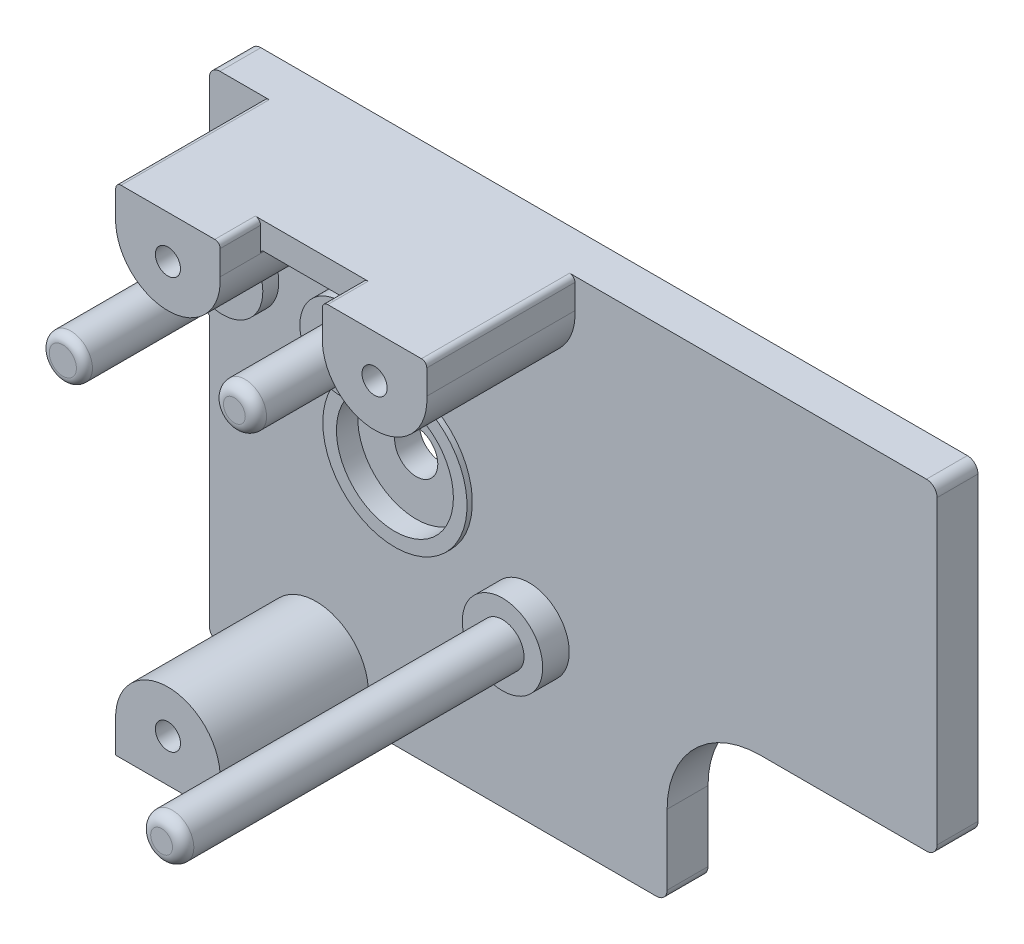
from build123d import *

# Parameters (mm, degrees)
SALIENTE_EXTRUIR1_DEPTH    = 3.84
SALIENTE_EXTRUIR2_DEPTH    = 27.82
CROQUIS5_W                 = 19.2
CROQUIS5_H                 = 4.96
SALIENTE_EXTRUIR3_DEPTH    = 20.22
REDONDEO1_R                = 0.6
REDONDEO4_R                = 0.6
CROQUIS6_R                 = 2.36
CORTAR_EXTRUIR1_DEPTH      = 53.95
SALIENTE_EXTRUIR6_DEPTH    = 27.82
CORTAR_EXTRUIR9_DEPTH      = 53
CORTAR_EXTRUIR9_DEPTH_BACK = 66
CROQUIS10_R                = 2.36
REDONDEO5_R                = 5
REDONDEO6_R                = 5
CROQUIS12_R                = 4.05
CORTAR_EXTRUIR10_DEPTH     = 15
REDONDEO8_R                = 2
REDONDEO9_R                = 1
REDONDEO10_R               = 1
REDONDEO12_R               = 2
REDONDEO13_R               = 1
REDONDEO14_R               = 1
REDONDEO15_R               = 2
REDONDEO16_R               = 2
REDONDEO17_R               = 2
REDONDEO18_R               = 1
CROQUIS14_R                = 13.54
SALIENTE_EXTRUIR7_DEPTH    = 1
CROQUIS15_R                = 10.98
CORTAR_EXTRUIR12_DEPTH     = 4
CROQUIS16_R                = 4.05
CORTAR_EXTRUIR13_DEPTH     = 24
CROQUIS17_R                = 7.545
SALIENTE_EXTRUIR8_DEPTH    = 3
SALIENTE_EXTRUIR9_DEPTH    = 5
SALIENTE_EXTRUIR10_DEPTH   = 4
SALIENTE_EXTRUIR11_START   = 20
CROQUIS23_R                = 4.05
SALIENTE_EXTRUIR11_DEPTH   = 20
SALIENTE_EXTRUIR12_START   = 30
CROQUIS18_R                = 4.05
SALIENTE_EXTRUIR12_DEPTH   = 30
REDONDEO19_R               = 1.5
REDONDEO20_R               = 2
CROQUIS24_R                = 7.545
SALIENTE_EXTRUIR13_DEPTH   = 5
CROQUIS25_R                = 4.05
SALIENTE_EXTRUIR14_DEPTH   = 64
REDONDEO21_R               = 2


with BuildPart() as part:
    # Croquis1 → Saliente-Extruir1 (new, symmetric)
    with BuildSketch(Plane.XY):
        with BuildLine():
            Line((-68.325, 28.78), (68.325, 28.78))
            Line((68.325, 28.78), (68.325, -31.7))
            Line((68.325, -31.7), (35.165, -31.7))
            ThreePointArc((35.165, -31.7), (22.769418126, -36.834418126), (17.635, -49.23))
            Line((17.635, -49.23), (17.635, -64.4))
            Line((17.635, -64.4), (-68.325, -64.4))
            Line((-68.325, -64.4), (-68.325, -11.9))
            Line((-68.325, -11.9), (-73.325, -7.775))
            Line((-73.325, -7.775), (-73.325, 7.775))
            Line((-73.325, 7.775), (-68.325, 11.9))
            Line((-68.325, 11.9), (-68.325, 28.78))
        make_face()
    extrude(amount=SALIENTE_EXTRUIR1_DEPTH, both=True)

    # Croquis2 → Saliente-Extruir2 (add)
    with BuildSketch(Plane.XY.offset(3.84)):
        with BuildLine():
            Line((-58.075, 23.18), (-58.075, 28.78))
            Line((-58.075, 28.78), (-38.475, 28.78))
            Line((-38.475, 28.78), (-38.475, 23.18))
            ThreePointArc((-38.475, 23.18), (-48.275, 12.78), (-58.075, 23.18))
        make_face()
        with BuildLine():
            Line((-19.275, 23.18), (-19.275, 28.78))
            Line((-19.275, 28.78), (0.325, 28.78))
            Line((0.325, 28.78), (0.325, 23.18))
            ThreePointArc((0.325, 23.18), (-9.475, 12.78), (-19.275, 23.18))
        make_face()
    extrude(amount=SALIENTE_EXTRUIR2_DEPTH)

    # Croquis5 → Saliente-Extruir3 (add)
    with BuildSketch(Plane.XY.offset(3.84)):
        with Locations((-28.875, 26.3)):
            Rectangle(CROQUIS5_W, CROQUIS5_H)
    extrude(amount=SALIENTE_EXTRUIR3_DEPTH)

    # Redondeo1
    redondeo1_edges = [part.edges().sort_by_distance(p)[0] for p in [
        (-38.475, 23.82, 13.95),
    ]]
    fillet(redondeo1_edges, radius=REDONDEO1_R)

    # Redondeo4
    redondeo4_edges = [part.edges().sort_by_distance(p)[0] for p in [
        (-19.275, 23.82, 13.95),
    ]]
    fillet(redondeo4_edges, radius=REDONDEO4_R)

    # Croquis6 → Cortar-Extruir1 (cut, symmetric)
    with BuildSketch(Plane.XY):
        with Locations((-48.275, 20.78)):
            Circle(CROQUIS6_R)
        with Locations((-9.475, 20.78)):
            Circle(CROQUIS6_R)
    extrude(amount=CORTAR_EXTRUIR1_DEPTH, both=True, mode=Mode.SUBTRACT)

    # Croquis9 → Saliente-Extruir6 (add)
    with BuildSketch(Plane.XY.offset(3.84)):
        with BuildLine():
            Line((-58.075, -58.8), (-58.075, -64.4))
            Line((-58.075, -64.4), (-38.475, -64.4))
            Line((-38.475, -64.4), (-38.475, -58.8))
            ThreePointArc((-38.475, -58.8), (-48.275, -48.4), (-58.075, -58.8))
        make_face()
    extrude(amount=SALIENTE_EXTRUIR6_DEPTH)

    # Croquis10 → Cortar-Extruir9 (cut, two sides: drawn at the far end of the back side and taken through both)
    with BuildSketch(Plane.XY.offset(3.84).offset(-CORTAR_EXTRUIR9_DEPTH_BACK)):
        with Locations(Location((-48.275, -56.4, 0), (0, 0, 180))):
            Circle(CROQUIS10_R)
    extrude(amount=CORTAR_EXTRUIR9_DEPTH + CORTAR_EXTRUIR9_DEPTH_BACK, mode=Mode.SUBTRACT)

    # Redondeo5
    redondeo5_edges = [part.edges().sort_by_distance(p)[0] for p in [
        (-73.325, -7.775, 0),
    ]]
    fillet(redondeo5_edges, radius=REDONDEO5_R)

    # Redondeo6
    redondeo6_edges = [part.edges().sort_by_distance(p)[0] for p in [
        (-73.325, 7.775, 0),
    ]]
    fillet(redondeo6_edges, radius=REDONDEO6_R)

    # Croquis12 → Cortar-Extruir10 (cut, symmetric)
    with BuildSketch(Plane.XY.offset(3.84)):
        with Locations(Location((-62.825, 0, 0), (0, 0, 180))):
            Circle(CROQUIS12_R)
        with Locations(Location((-38.625, 0, 0), (0, 0, 180))):
            Circle(CROQUIS12_R)
    extrude(amount=CORTAR_EXTRUIR10_DEPTH, both=True, mode=Mode.SUBTRACT)

    # Redondeo8
    redondeo8_edges = [part.edges().sort_by_distance(p)[0] for p in [
        (-68.325, 28.78, 0),
    ]]
    fillet(redondeo8_edges, radius=REDONDEO8_R)

    # Redondeo9
    redondeo9_edges = [part.edges().sort_by_distance(p)[0] for p in [
        (-58.075, 28.78, 17.75),
    ]]
    fillet(redondeo9_edges, radius=REDONDEO9_R)

    # Redondeo10
    redondeo10_edges = [part.edges().sort_by_distance(p)[0] for p in [
        (-19.275, 28.78, 27.86),
    ]]
    fillet(redondeo10_edges, radius=REDONDEO10_R)

    # Redondeo12
    redondeo12_edges = [part.edges().sort_by_distance(p)[0] for p in [
        (-68.325, -64.4, 0),
    ]]
    fillet(redondeo12_edges, radius=REDONDEO12_R)

    # Redondeo13
    redondeo13_edges = [part.edges().sort_by_distance(p)[0] for p in [
        (-38.475, 28.78, 27.86),
    ]]
    fillet(redondeo13_edges, radius=REDONDEO13_R)

    # Redondeo14
    redondeo14_edges = [part.edges().sort_by_distance(p)[0] for p in [
        (0.325, 28.78, 17.75),
    ]]
    fillet(redondeo14_edges, radius=REDONDEO14_R)

    # Redondeo15
    redondeo15_edges = [part.edges().sort_by_distance(p)[0] for p in [
        (68.325, 28.78, 0),
    ]]
    fillet(redondeo15_edges, radius=REDONDEO15_R)

    # Redondeo16
    redondeo16_edges = [part.edges().sort_by_distance(p)[0] for p in [
        (68.325, -31.7, 0),
    ]]
    fillet(redondeo16_edges, radius=REDONDEO16_R)

    # Redondeo17
    redondeo17_edges = [part.edges().sort_by_distance(p)[0] for p in [
        (17.635, -64.4, 0),
    ]]
    fillet(redondeo17_edges, radius=REDONDEO17_R)

    # Redondeo18
    redondeo18_edges = [part.edges().sort_by_distance(p)[0] for p in [
        (-38.475, -64.4, 17.75),
    ]]
    fillet(redondeo18_edges, radius=REDONDEO18_R)

    # Croquis14 → Saliente-Extruir7 (add)
    with BuildSketch(Plane.XY.offset(3.84)):
        with Locations(Location((-32.475, -17.65, 0), (0, 0, 180))):
            Circle(CROQUIS14_R)
    extrude(amount=SALIENTE_EXTRUIR7_DEPTH)

    # Croquis15 → Cortar-Extruir12 (cut)
    with BuildSketch(Plane.XY.offset(4.84)):
        with Locations((-32.475, -17.65)):
            Circle(CROQUIS15_R)
    extrude(amount=-CORTAR_EXTRUIR12_DEPTH, mode=Mode.SUBTRACT)

    # Croquis16 → Cortar-Extruir13 (cut)
    with BuildSketch(Plane.XY.offset(0.84)):
        with Locations((-32.475, -17.65)):
            Circle(CROQUIS16_R)
    extrude(amount=-CORTAR_EXTRUIR13_DEPTH, mode=Mode.SUBTRACT)

    # Croquis17 → Saliente-Extruir8 (add)
    with BuildSketch(Plane.XY.offset(3.84)):
        with Locations(Location((-62.825, 0, 0), (0, 0, 180))):
            Circle(CROQUIS17_R)
    extrude(amount=SALIENTE_EXTRUIR8_DEPTH)

    # Croquis20 → Saliente-Extruir9 (add)
    with BuildSketch(Plane.XY.offset(3.84)):
        with BuildLine():
            ThreePointArc((-32.12244902, -4.114590593), (-41.156957864, 7.26651322), (-41.162580782, -7.264551519))
            ThreePointArc((-41.162580782, -7.264551519), (-36.930192915, -4.863958545), (-32.12244902, -4.114590593))
        make_face()
    extrude(amount=SALIENTE_EXTRUIR9_DEPTH)

    # Croquis22 → Saliente-Extruir10 (add)
    with BuildSketch(Plane.XY.offset(4.84)):
        with BuildLine():
            ThreePointArc((-41.158112573, -7.260815429), (-36.094687333, -7.261791639), (-32.128271446, -4.114440192))
            ThreePointArc((-32.128271446, -4.114440192), (-36.930192915, -4.863958545), (-41.158112573, -7.260815429))
        make_face()
    extrude(amount=SALIENTE_EXTRUIR10_DEPTH)

    # Croquis23 → Saliente-Extruir11 (add)
    with BuildSketch(Plane.XY.offset(8.84).offset(SALIENTE_EXTRUIR11_START)):
        with Locations(Location((-38.625, 0, 0), (0, 0, 180))):
            Circle(CROQUIS23_R)
    extrude(amount=-SALIENTE_EXTRUIR11_DEPTH)

    # Croquis18 → Saliente-Extruir12 (add)
    with BuildSketch(Plane.XY.offset(6.84).offset(SALIENTE_EXTRUIR12_START)):
        with Locations(Location((-62.825, 0, 0), (0, 0, 180))):
            Circle(CROQUIS18_R)
    extrude(amount=-SALIENTE_EXTRUIR12_DEPTH)

    # Redondeo19
    redondeo19_edges = [part.edges().sort_by_distance(p)[0] for p in [
        (-58.775, 0, 36.84),
    ]]
    fillet(redondeo19_edges, radius=REDONDEO19_R)

    # Redondeo20
    redondeo20_edges = [part.edges().sort_by_distance(p)[0] for p in [
        (-34.575, 0, 28.84),
    ]]
    fillet(redondeo20_edges, radius=REDONDEO20_R)

    # Croquis24 → Saliente-Extruir13 (add)
    with BuildSketch(Plane.XY.offset(3.84)):
        with Locations(Location((-8.283343025, -32.895909544, 0), (0, 0, 180))):
            Circle(CROQUIS24_R)
    extrude(amount=SALIENTE_EXTRUIR13_DEPTH)

    # Croquis25 → Saliente-Extruir14 (add)
    with BuildSketch(Plane.XY.offset(8.84)):
        with Locations((-8.283343025, -32.895909544)):
            Circle(CROQUIS25_R)
    extrude(amount=SALIENTE_EXTRUIR14_DEPTH)

    # Redondeo21
    redondeo21_edges = [part.edges().sort_by_distance(p)[0] for p in [
        (-12.333343025, -32.895909544, 72.84),
    ]]
    fillet(redondeo21_edges, radius=REDONDEO21_R)


solid = part.part
